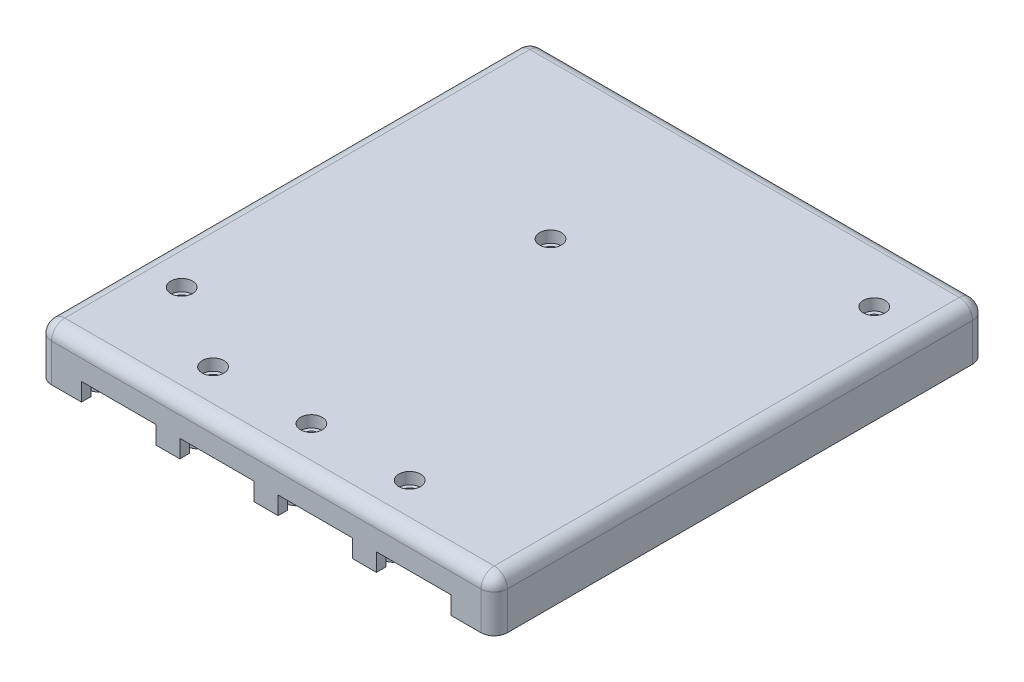
from build123d import *

# Parameters (mm, degrees)
SKETCH1_W           = 85.8
SKETCH1_H           = 92.5
SKETCH1_R           = 2.05
BOSS_EXTRUDE1_DEPTH = 3.175
SKETCH2_W           = 85.8
SKETCH2_H           = 92.5
SKETCH2_R           = 1.35
SKETCH2_R_2         = 3.35
BOSS_EXTRUDE2_DEPTH = 1.905
BOSS_EXTRUDE3_START = 1
SKETCH2_3_W         = 85.8
SKETCH2_3_H         = 92.5
SKETCH2_3_R         = 1.35
SKETCH2_3_R_2       = 3.35
BOSS_EXTRUDE3_DEPTH = 1
SKETCH3_W           = 85.8
SKETCH3_H           = 92.5
SKETCH3_W_2         = 75.8
SKETCH3_H_2         = 82.5
BOSS_EXTRUDE4_DEPTH = 4.55
SKETCH4_W           = 14
SKETCH4_H           = 6.75
CUT_EXTRUDE1_DEPTH  = 118.864146478
SKETCH5_W           = 10
SKETCH5_H           = 6
CUT_EXTRUDE2_DEPTH  = 118.864146478
BOSS_EXTRUDE5_DEPTH = 3.5
FILLET1_R           = 2.5
FILLET2_R           = 2.5
FILLET3_R           = 2.5
FILLET4_R           = 2.5
FILLET5_R           = 2.5
CUT_EXTRUDE3_DEPTH  = 3.36
CUT_EXTRUDE4_DEPTH  = 75
SKETCH10_W          = 4.501
SKETCH10_H          = 3
BOSS_EXTRUDE6_DEPTH = 5


with BuildPart() as part:
    # Sketch1 → Boss-Extrude1 (new body)
    with BuildSketch(Plane(origin=(0, 0, 0), x_dir=(1, 0, 0), z_dir=(0, 1, 0))):
        with Locations((36.9, 40.25)):
            Rectangle(SKETCH1_W, SKETCH1_H)
        with Locations((2.5, 12.5)):
            Circle(SKETCH1_R, mode=Mode.SUBTRACT)
        with Locations((18.4, 2.5)):
            Circle(SKETCH1_R, mode=Mode.SUBTRACT)
        with Locations((36.9, 2.5)):
            Circle(SKETCH1_R, mode=Mode.SUBTRACT)
        with Locations((55.4, 2.5)):
            Circle(SKETCH1_R, mode=Mode.SUBTRACT)
        with Locations((29.3, 55.1)):
            Circle(SKETCH1_R, mode=Mode.SUBTRACT)
        with Locations((70.8, 74.5)):
            Circle(SKETCH1_R, mode=Mode.SUBTRACT)
    extrude(amount=BOSS_EXTRUDE1_DEPTH)

    # Sketch2 → Boss-Extrude2 (add)
    # profile 1 of 2: a face of its own
    with BuildSketch(Plane(origin=(0, 0, 0), x_dir=(1, 0, 0), z_dir=(0, 1, 0))):
        with Locations((36.9, 40.25)):
            Rectangle(SKETCH2_W, SKETCH2_H)
        with Locations((2.5, 12.5)):
            Circle(SKETCH2_R, mode=Mode.SUBTRACT)
        with Locations((18.4, 2.5)):
            Circle(SKETCH2_R, mode=Mode.SUBTRACT)
        with Locations((36.9, 2.5)):
            Circle(SKETCH2_R, mode=Mode.SUBTRACT)
        with Locations((55.4, 2.5)):
            Circle(SKETCH2_R, mode=Mode.SUBTRACT)
        with BuildLine():
            Line((-1, 7.5), (2.5, 7.5))
            ThreePointArc((2.5, 7.5), (7.5, 12.5), (2.5, 17.5))
            Line((2.5, 17.5), (-1, 17.5))
            Line((-1, 17.5), (-1, 81.5))
            Line((-1, 81.5), (65.8, 81.5))
            Line((65.8, 81.5), (65.8, 74.5))
            ThreePointArc((65.8, 74.5), (67.264466094, 70.964466094), (70.8, 69.5))
            Line((70.8, 69.5), (74.8, 69.5))
            Line((74.8, 69.5), (74.8, -1))
            Line((74.8, -1), (60.4, -1))
            Line((60.4, -1), (60.4, 2.5))
            ThreePointArc((60.4, 2.5), (55.4, 7.5), (50.4, 2.5))
            Line((50.4, 2.5), (50.4, -1))
            Line((50.4, -1), (41.9, -1))
            Line((41.9, -1), (41.9, 2.5))
            ThreePointArc((41.9, 2.5), (36.9, 7.5), (31.9, 2.5))
            Line((31.9, 2.5), (31.9, -1))
            Line((31.9, -1), (23.4, -1))
            Line((23.4, -1), (23.4, 2.5))
            ThreePointArc((23.4, 2.5), (18.4, 7.5), (13.4, 2.5))
            Line((13.4, 2.5), (13.4, -1))
            Line((13.4, -1), (-1, -1))
            Line((-1, -1), (-1, 7.5))
        make_face(mode=Mode.SUBTRACT)
        with Locations((70.8, 74.5)):
            Circle(SKETCH2_R, mode=Mode.SUBTRACT)
    # profile 2 of 2: a face of its own
    with BuildSketch(Plane(origin=(0, 0, 0), x_dir=(1, 0, 0), z_dir=(0, 1, 0))):
        with Locations((29.3, 55.1)):
            Circle(SKETCH2_R_2)
        with Locations((29.3, 55.1)):
            Circle(SKETCH2_R, mode=Mode.SUBTRACT)
    extrude(amount=-BOSS_EXTRUDE2_DEPTH)

    # Sketch2<3> → Boss-Extrude3 (add)
    # profile 1 of 2: a face of its own
    with BuildSketch(Plane(origin=(0, 0, 0), x_dir=(1, 0, 0), z_dir=(0, 1, 0)).offset(BOSS_EXTRUDE3_START)):
        with Locations((36.9, 40.25)):
            Rectangle(SKETCH2_3_W, SKETCH2_3_H)
        with Locations((2.5, 12.5)):
            Circle(SKETCH2_3_R, mode=Mode.SUBTRACT)
        with Locations((18.4, 2.5)):
            Circle(SKETCH2_3_R, mode=Mode.SUBTRACT)
        with Locations((36.9, 2.5)):
            Circle(SKETCH2_3_R, mode=Mode.SUBTRACT)
        with Locations((55.4, 2.5)):
            Circle(SKETCH2_3_R, mode=Mode.SUBTRACT)
        with BuildLine():
            Line((-1, 7.5), (2.5, 7.5))
            ThreePointArc((2.5, 7.5), (7.5, 12.5), (2.5, 17.5))
            Line((2.5, 17.5), (-1, 17.5))
            Line((-1, 17.5), (-1, 81.5))
            Line((-1, 81.5), (65.8, 81.5))
            Line((65.8, 81.5), (65.8, 74.5))
            ThreePointArc((65.8, 74.5), (67.264466094, 70.964466094), (70.8, 69.5))
            Line((70.8, 69.5), (74.8, 69.5))
            Line((74.8, 69.5), (74.8, -1))
            Line((74.8, -1), (60.4, -1))
            Line((60.4, -1), (60.4, 2.5))
            ThreePointArc((60.4, 2.5), (55.4, 7.5), (50.4, 2.5))
            Line((50.4, 2.5), (50.4, -1))
            Line((50.4, -1), (41.9, -1))
            Line((41.9, -1), (41.9, 2.5))
            ThreePointArc((41.9, 2.5), (36.9, 7.5), (31.9, 2.5))
            Line((31.9, 2.5), (31.9, -1))
            Line((31.9, -1), (23.4, -1))
            Line((23.4, -1), (23.4, 2.5))
            ThreePointArc((23.4, 2.5), (18.4, 7.5), (13.4, 2.5))
            Line((13.4, 2.5), (13.4, -1))
            Line((13.4, -1), (-1, -1))
            Line((-1, -1), (-1, 7.5))
        make_face(mode=Mode.SUBTRACT)
        with Locations((70.8, 74.5)):
            Circle(SKETCH2_3_R, mode=Mode.SUBTRACT)
    # profile 2 of 2: a face of its own
    with BuildSketch(Plane(origin=(0, 0, 0), x_dir=(1, 0, 0), z_dir=(0, 1, 0)).offset(BOSS_EXTRUDE3_START)):
        with Locations((29.3, 55.1)):
            Circle(SKETCH2_3_R_2)
        with Locations((29.3, 55.1)):
            Circle(SKETCH2_3_R, mode=Mode.SUBTRACT)
    extrude(amount=-BOSS_EXTRUDE3_DEPTH)

    # Sketch3 → Boss-Extrude4 (add)
    with BuildSketch(Plane(origin=(0, -1.905, 0), x_dir=(-1, 0, 0), z_dir=(0, -1, 0))):
        with Locations((-36.9, 40.25)):
            Rectangle(SKETCH3_W, SKETCH3_H)
        with Locations((-36.9, 40.25)):
            Rectangle(SKETCH3_W_2, SKETCH3_H_2, mode=Mode.SUBTRACT)
    extrude(amount=BOSS_EXTRUDE4_DEPTH)

    # Sketch4 → Cut-Extrude1 (cut, through all)
    with BuildSketch(Plane.XY):
        with Locations((9.15, -6.47)):
            Rectangle(SKETCH4_W, SKETCH4_H)
        with Locations((27.65, -6.47)):
            Rectangle(SKETCH4_W, SKETCH4_H)
        with Locations((46.15, -6.47)):
            Rectangle(SKETCH4_W, SKETCH4_H)
        with Locations((64.65, -6.47)):
            Rectangle(SKETCH4_W, SKETCH4_H)
    extrude(amount=CUT_EXTRUDE1_DEPTH, mode=Mode.SUBTRACT)

    # Sketch5 → Cut-Extrude2 (cut, through all)
    with BuildSketch(Plane.XY):
        with Locations((58, -7.455)):
            Rectangle(SKETCH5_W, SKETCH5_H)
    extrude(amount=-CUT_EXTRUDE2_DEPTH, mode=Mode.SUBTRACT)

    # Sketch6 → Boss-Extrude5 (add)
    with BuildSketch(Plane.ZY.offset(6)):
        with BuildLine():
            Line((-59.6, 0), (-59.6, -8.95))
            Line((-59.6, -8.95), (-59.131128874, -8.95))
            ThreePointArc((-59.131128874, -8.95), (-55.1, -6.45), (-51.068871126, -8.95))
            Line((-51.068871126, -8.95), (-50.6, -8.95))
            Line((-50.6, -8.95), (-50.6, 0))
            Line((-50.6, 0), (-59.6, 0))
        make_face()
    extrude(amount=-BOSS_EXTRUDE5_DEPTH)

    # Fillet1
    fillet1_edges = [part.edges().sort_by_distance(p)[0] for p in [
        (79.8, -1.64, 6),
    ]]
    fillet(fillet1_edges, radius=FILLET1_R)

    # Fillet2
    fillet2_edges = [part.edges().sort_by_distance(p)[0] for p in [
        (79.8, -1.64, -86.5),
    ]]
    fillet(fillet2_edges, radius=FILLET2_R)

    # Fillet3
    fillet3_edges = [part.edges().sort_by_distance(p)[0] for p in [
        (-6, -1.64, -86.5),
    ]]
    fillet(fillet3_edges, radius=FILLET3_R)

    # Fillet4
    fillet4_edges = [part.edges().sort_by_distance(p)[0] for p in [
        (-6, -1.64, 6),
    ]]
    fillet(fillet4_edges, radius=FILLET4_R)

    # Fillet5
    fillet5_edges = [part.edges().sort_by_distance(p)[0] for p in [
        (79.067766953, 3.175, -85.767766953),
        (79.8, 3.175, -40.25),
        (79.067766953, 3.175, 5.267766953),
        (36.9, 3.175, 6),
        (-5.267766953, 3.175, 5.267766953),
        (-6, 3.175, -40.25),
        (-5.267766953, 3.175, -85.767766953),
        (36.9, 3.175, -86.5),
    ]]
    fillet(fillet5_edges, radius=FILLET5_R)

    # Sketch7 → Cut-Extrude3 (cut)
    with BuildSketch(Plane(origin=(0, -6.455, 0), x_dir=(-1, 0, 0), z_dir=(0, -1, 0))):
        Polygon((-2.15, -2.8), (-0.9, -3.5), (-2.15, -4.2), align=None)
        Polygon((-16.15, -2.8), (-17.4, -3.5), (-16.15, -4.2), align=None)
        Polygon((-20.65, -2.8), (-19.4, -3.5), (-20.65, -4.2), align=None)
        Polygon((-34.65, -2.8), (-35.9, -3.5), (-34.65, -4.2), align=None)
        Polygon((-39.15, -2.8), (-39.15, -4.2), (-37.9, -3.5), align=None)
        Polygon((-53.15, -2.8), (-53.15, -4.2), (-54.4, -3.5), align=None)
        Polygon((-57.65, -4.2), (-56.4, -3.5), (-57.65, -2.8), align=None)
        Polygon((-71.65, -2.8), (-72.9, -3.5), (-71.65, -4.2), align=None)
    extrude(amount=-CUT_EXTRUDE3_DEPTH, mode=Mode.SUBTRACT)

    # Sketch8 → Cut-Extrude4 (cut)
    with BuildSketch(Plane(origin=(0, 0, 0), x_dir=(0, 0, -1), z_dir=(1, 0, 0))):
        Polygon((-4.2, -3.15), (-2.8, -3.15), (-3.5, -1.85), align=None)
    extrude(amount=CUT_EXTRUDE4_DEPTH, mode=Mode.SUBTRACT)

    # Sketch10 → Boss-Extrude6 (add)
    with BuildSketch(Plane.XY.offset(6)):
        with Locations((-0.1005, -1.595)):
            Rectangle(SKETCH10_W, SKETCH10_H)
        with Locations((18.3995, -1.595)):
            Rectangle(SKETCH10_W, SKETCH10_H)
        with Locations((36.8995, -1.595)):
            Rectangle(SKETCH10_W, SKETCH10_H)
        with Locations((55.3995, -1.595)):
            Rectangle(SKETCH10_W, SKETCH10_H)
        with Locations((73.9005, -1.595)):
            Rectangle(SKETCH10_W, SKETCH10_H)
    extrude(amount=-BOSS_EXTRUDE6_DEPTH)


solid = part.part
